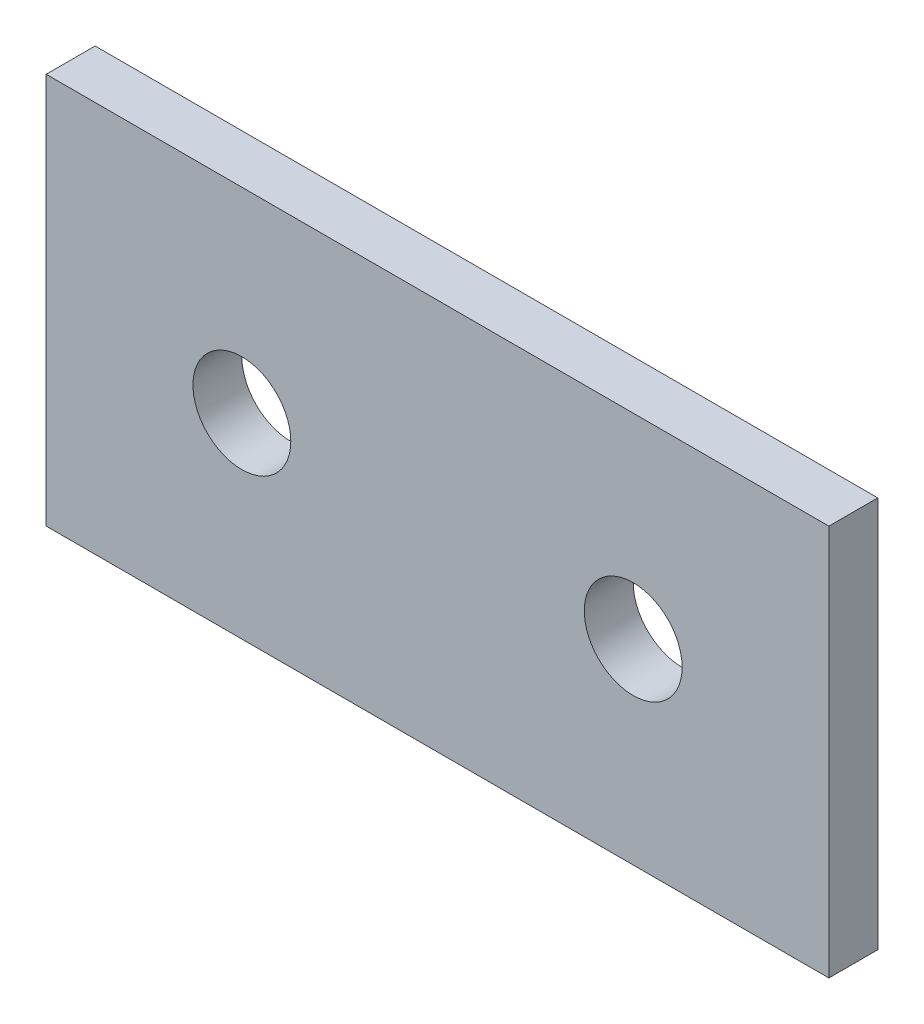
from build123d import *

# Parameters (mm, degrees)
SKETCH1_W           = 50.8
SKETCH1_H           = 25.4
BOSS_EXTRUDE1_DEPTH = 3.175
CUT_EXTRUDE1_REACH  = 58.885
SKETCH2_R           = 3.175


with BuildPart() as part:
    # Sketch1 → Boss-Extrude1 (new body)
    with BuildSketch(Plane.XY):
        with Locations((25.4, 12.7)):
            Rectangle(SKETCH1_W, SKETCH1_H)
    extrude(amount=BOSS_EXTRUDE1_DEPTH)

    # Sketch2 → Cut-Extrude1 (cut, up to next)
    with BuildSketch(Plane.XY.offset(3.175), mode=Mode.PRIVATE) as cut_extrude1_sk1:
        with Locations((12.7, 12.7)):
            Circle(SKETCH2_R)
    cut_extrude1_tool1 = extrude(cut_extrude1_sk1.sketch, amount=-CUT_EXTRUDE1_REACH, mode=Mode.PRIVATE) & part.part
    # Sketch2 → Cut-Extrude1 (cut, up to next)
    with BuildSketch(Plane.XY.offset(3.175), mode=Mode.PRIVATE) as cut_extrude1_sk2:
        with Locations((38.1, 12.7)):
            Circle(SKETCH2_R)
    cut_extrude1_tool2 = extrude(cut_extrude1_sk2.sketch, amount=-CUT_EXTRUDE1_REACH, mode=Mode.PRIVATE) & part.part
    add(cut_extrude1_tool1.solids().sort_by_distance((12.7, 12.7, 3.175))[0], mode=Mode.SUBTRACT)
    add(cut_extrude1_tool2.solids().sort_by_distance((38.1, 12.7, 3.175))[0], mode=Mode.SUBTRACT)


solid = part.part
